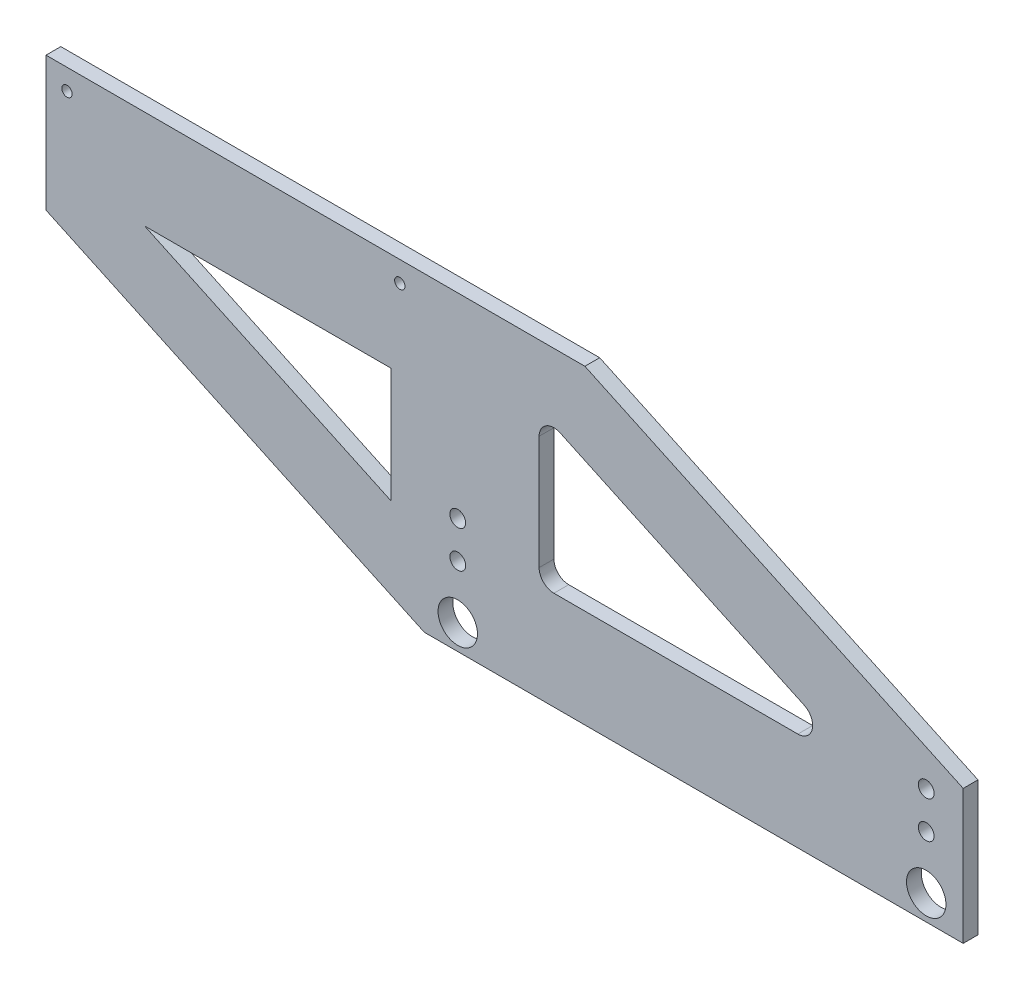
from build123d import *

# Parameters (mm, degrees)
SKETCH1_R      = 1.05
SKETCH1_R_2    = 4
SKETCH1_R_3    = 1.6
EXTRUDE1_DEPTH = 3
FILLET1_R      = 3


with BuildPart() as part:
    # Sketch1 → Extrude1 (new body)
    with BuildSketch(Plane.XY):
        Polygon((-83.5, 74.115427319), (25.779226165, 74.115427319), (102.5, 38.33994294), (102.5, 11.115427319), (-6.779226165, 11.115427319), (-83.5, 46.890911697), align=None)
        with Locations((-79.25, 69.915427319)):
            Circle(SKETCH1_R, mode=Mode.SUBTRACT)
        with Locations((-11.75, 69.915427319)):
            Circle(SKETCH1_R, mode=Mode.SUBTRACT)
        with Locations((0, 16.201854058)):
            Circle(SKETCH1_R_2, mode=Mode.SUBTRACT)
        with Locations((95, 16.201854058)):
            Circle(SKETCH1_R_2, mode=Mode.SUBTRACT)
        with Locations((95, 27)):
            Circle(SKETCH1_R_3, mode=Mode.SUBTRACT)
        with Locations((95, 34.5)):
            Circle(SKETCH1_R_3, mode=Mode.SUBTRACT)
        with Locations((0, 34.5)):
            Circle(SKETCH1_R_3, mode=Mode.SUBTRACT)
        with Locations((0, 27)):
            Circle(SKETCH1_R_3, mode=Mode.SUBTRACT)
        Polygon((-63.5, 54.115427319), (-13.5, 54.115427319), (-13.5, 30.800044411), align=None, mode=Mode.SUBTRACT)
        Polygon((16.5, 61.891732757), (16.5, 31.115427319), (82.5, 31.115427319), align=None, mode=Mode.SUBTRACT)
    extrude(amount=EXTRUDE1_DEPTH)

    # Fillet1
    fillet1_edges = [part.edges().sort_by_distance(p)[0] for p in [
        (82.5, 31.115427319, 1.5),
        (16.5, 61.891732757, 1.5),
        (16.5, 31.115427319, 1.5),
    ]]
    fillet(fillet1_edges, radius=FILLET1_R)


solid = part.part
